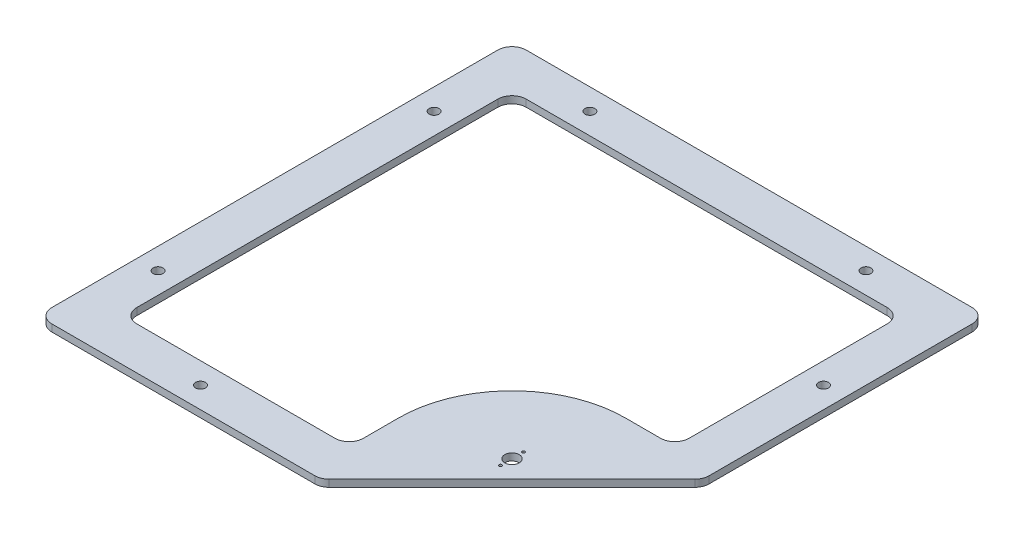
from build123d import *

# Parameters (mm, degrees)
SKETCH1_W                = 425.45
SKETCH1_H                = 425.45
BOSS_EXTRUDE1_DEPTH      = 3.175
CUT_EXTRUDE1_DEPTH       = 301.90558943
SKETCH3_R                = 6.477
SKETCH3_R_2              = 1.27
CUT_EXTRUDE2_DEPTH       = 301.90558943
F_0_332_DIAMETER_HOLE1_D = 8.8392
CUT_EXTRUDE3_DEPTH       = 301.90558943
FILLET1_R                = 12.7
FILLET2_R                = 101.6


with BuildPart() as part:
    # Sketch1 → Boss-Extrude1 (new, symmetric)
    with BuildSketch(Plane(origin=(0, 0, 0), x_dir=(1, 0, 0), z_dir=(0, 1, 0))):
        Rectangle(SKETCH1_W, SKETCH1_H)
    extrude(amount=BOSS_EXTRUDE1_DEPTH, both=True)

    # Sketch2 → Cut-Extrude1 (cut, through all)
    with BuildSketch(Plane(origin=(0, 3.175, 0), x_dir=(1, 0, 0), z_dir=(0, 1, 0))):
        Polygon((212.725, -212.725), (212.725, -41.275), (41.275, -212.725), align=None)
    extrude(amount=-CUT_EXTRUDE1_DEPTH, mode=Mode.SUBTRACT)

    # Sketch3 → Cut-Extrude2 (cut, through all)
    with BuildSketch(Plane(origin=(0, 3.175, 0), x_dir=(1, 0, 0), z_dir=(0, 1, 0))):
        with Locations(Location((111.125, -111.125, 0), (0, 0, 270))):
            Circle(SKETCH3_R)
        with Locations(Location((111.125, -100.7999, 0), (0, 0, 270))):
            Circle(SKETCH3_R_2)
        with Locations(Location((111.125, -121.4501, 0), (0, 0, 270))):
            Circle(SKETCH3_R_2)
    extrude(amount=-CUT_EXTRUDE2_DEPTH, mode=Mode.SUBTRACT)

    # 0.332_ Diameter Hole1 (through all)
    with Locations(Plane(origin=(0, 3.175, 0), x_dir=(1, 0, 0), z_dir=(0, 1, 0))):
        with Locations((-85.725, -193.675), (-193.675, -123.825), (-193.675, 123.825), (-123.825, 193.675), (123.825, 193.675), (193.675, 85.725)):
            Hole(F_0_332_DIAMETER_HOLE1_D / 2)

    # Sketch6 → Cut-Extrude3 (cut, through all)
    with BuildSketch(Plane(origin=(0, 3.175, 0), x_dir=(1, 0, 0), z_dir=(0, 1, 0))):
        Polygon((174.625, 174.625), (174.625, -28.575), (28.575, -28.575), (28.575, -174.625), (-174.625, -174.625), (-174.625, 174.625), align=None)
    extrude(amount=-CUT_EXTRUDE3_DEPTH, mode=Mode.SUBTRACT)

    # Fillet1
    fillet1_edges = [part.edges().sort_by_distance(p)[0] for p in [
        (41.275, 0, 212.725),
        (212.725, 0, 41.275),
        (-212.725, 0, 212.725),
        (-212.725, 0, -212.725),
        (-174.625, 0, -174.625),
        (212.725, 0, -212.725),
        (174.625, 0, -174.625),
        (174.625, 0, 28.575),
        (28.575, 0, 174.625),
        (-174.625, 0, 174.625),
    ]]
    fillet(fillet1_edges, radius=FILLET1_R)

    # Fillet2
    fillet2_edges = [part.edges().sort_by_distance(p)[0] for p in [
        (28.575, 0, 28.575),
    ]]
    fillet(fillet2_edges, radius=FILLET2_R)


solid = part.part
